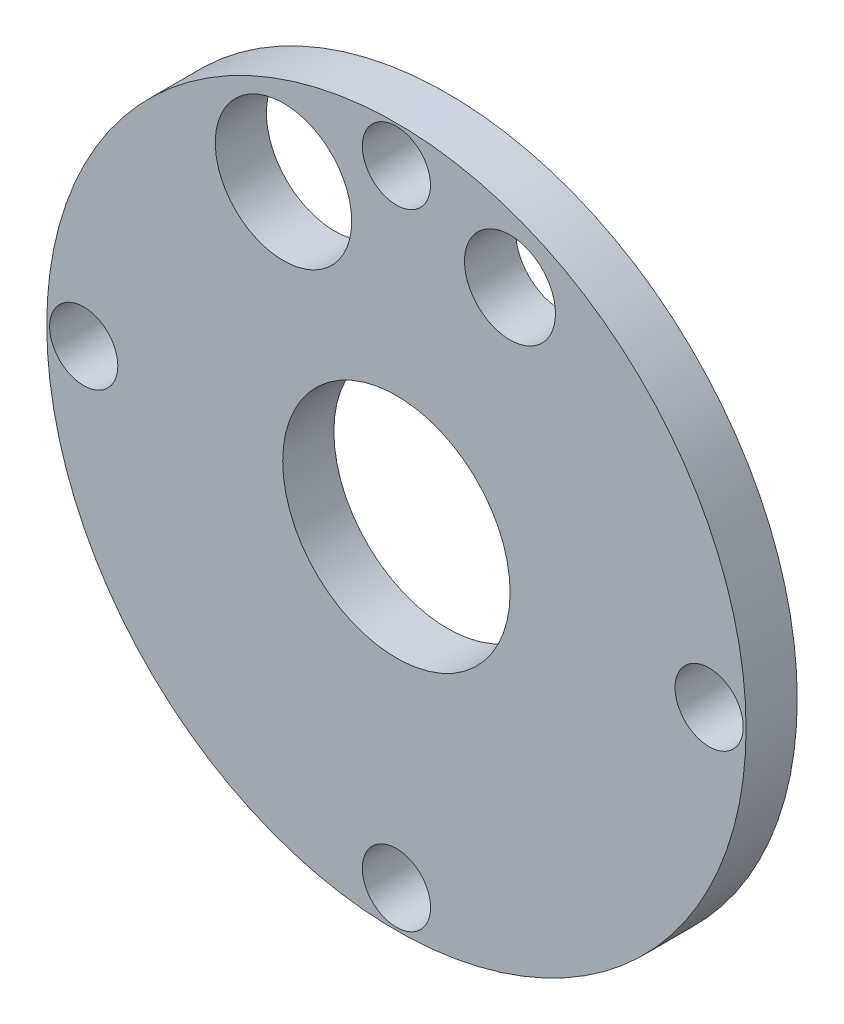
from build123d import *

# Parameters (mm, degrees)
ESQUISSE1_R                  = 30.75
BOSS_EXTRU_1_DEPTH           = 8
ESQUISSE2_R                  = 3
BOSS_EXTRU_2_DEPTH           = 56
ESQUISSE4_R                  = 30.75
BOSS_EXTRU_4_DEPTH           = 4.5
ESQUISSE6_R                  = 3
BOSS_EXTRU_5_DEPTH           = 40
ESQUISSE12_R                 = 4
ENL_V_MAT_EXTRU_1_DEPTH      = 6
ESQUISSE13_R                 = 6
ENL_V_MAT_EXTRU_2_DEPTH      = 10
ESQUISSE15_R                 = 10
ENL_V_MAT_EXTRU_3_DEPTH      = 10
ESQUISSE18_R                 = 30.75
BOSS_EXTRU_10_DEPTH          = 4.5
ESQUISSE19_R                 = 2.05
ENL_V_MAT_EXTRU_4_DEPTH      = 62
ESQUISSE20_R                 = 3.5
ENL_V_MAT_EXTRU_5_DEPTH      = 10
ESQUISSE21_R                 = 3
ENL_V_MAT_EXTRU_6_DEPTH      = 78.376514687
ENL_V_MAT_EXTRU_7_DEPTH      = 122.079003185
ENL_V_MAT_EXTRU_7_DEPTH_BACK = 122.079003185
ESQUISSE22_W                 = 61.5
ESQUISSE22_H                 = 64
ESQUISSE22_H_2               = 4.5


with BuildPart() as part:
    # Esquisse1 → Boss.-Extru.1 (new body)
    with BuildSketch(Plane.XY):
        Circle(ESQUISSE1_R)
    extrude(amount=BOSS_EXTRU_1_DEPTH)

    # Esquisse2 → Boss.-Extru.2 (add)
    with BuildSketch(Plane.XY.offset(8)):
        with Locations((0, 27.5)):
            Circle(ESQUISSE2_R)
        with Locations((27.5, 0)):
            Circle(ESQUISSE2_R)
        with Locations((-27.5, 0)):
            Circle(ESQUISSE2_R)
        with Locations((0, -27.5)):
            Circle(ESQUISSE2_R)
    extrude(amount=BOSS_EXTRU_2_DEPTH)

    # Esquisse4 → Boss.-Extru.4 (add)
    with BuildSketch(Plane.XY.offset(64)):
        Circle(ESQUISSE4_R)
    extrude(amount=BOSS_EXTRU_4_DEPTH)

    # Esquisse6 → Boss.-Extru.5 (add)
    with BuildSketch(Plane.XY.offset(68.5)):
        with Locations((0, -27.5)):
            Circle(ESQUISSE6_R)
        with Locations((-27.5, 0)):
            Circle(ESQUISSE6_R)
        with Locations((0, 27.5)):
            Circle(ESQUISSE6_R)
        with Locations((27.5, 0)):
            Circle(ESQUISSE6_R)
    extrude(amount=BOSS_EXTRU_5_DEPTH)

    # Esquisse12 → Enlèv. mat.-Extru.1 (cut)
    with BuildSketch(Plane.XY.offset(68.5)):
        with Locations((9.98690327, 23.224420757)):
            Circle(ESQUISSE12_R)
    extrude(amount=-ENL_V_MAT_EXTRU_1_DEPTH, mode=Mode.SUBTRACT)

    # Esquisse13 → Enlèv. mat.-Extru.2 (cut)
    with BuildSketch(Plane.XY.offset(68.5)):
        with Locations((-9.931529151, 21.298232995)):
            Circle(ESQUISSE13_R)
    extrude(amount=-ENL_V_MAT_EXTRU_2_DEPTH, mode=Mode.SUBTRACT)

    # Esquisse15 → Enlèv. mat.-Extru.3 (cut)
    with BuildSketch(Plane.XY.offset(68.5)):
        Circle(ESQUISSE15_R)
    extrude(amount=-ENL_V_MAT_EXTRU_3_DEPTH, mode=Mode.SUBTRACT)

    # Esquisse18 → Boss.-Extru.10 (add)
    with BuildSketch(Plane.XY.offset(108.5)):
        Circle(ESQUISSE18_R)
    extrude(amount=BOSS_EXTRU_10_DEPTH)

    # Esquisse19 → Enlèv. mat.-Extru.4 (cut)
    with BuildSketch(Plane.ZY.offset(30.75)):
        with Locations((4, 0.25)):
            Circle(ESQUISSE19_R)
    extrude(amount=-ENL_V_MAT_EXTRU_4_DEPTH, mode=Mode.SUBTRACT)

    # Esquisse20 → Enlèv. mat.-Extru.5 (cut)
    with BuildSketch(Plane.XY.offset(113)):
        with Locations((21.297953152, 14.912987345)):
            Circle(ESQUISSE20_R)
        with Locations((-14.912987345, 21.297953152)):
            Circle(ESQUISSE20_R)
        with Locations((-21.297953152, -14.912987345)):
            Circle(ESQUISSE20_R)
        with Locations((14.912987345, -21.297953152)):
            Circle(ESQUISSE20_R)
    extrude(amount=-ENL_V_MAT_EXTRU_5_DEPTH, mode=Mode.SUBTRACT)

    # Esquisse21 → Enlèv. mat.-Extru.6 (cut, through all)
    with BuildSketch(Plane(origin=(0, 0, 64), x_dir=(-1, 0, 0), z_dir=(0, 0, -1))):
        with Locations((0, 27.5)):
            Circle(ESQUISSE21_R)
        with Locations((-27.5, 0)):
            Circle(ESQUISSE21_R)
        with Locations((0, -27.5)):
            Circle(ESQUISSE21_R)
        with Locations((27.5, 0)):
            Circle(ESQUISSE21_R)
    extrude(amount=-ENL_V_MAT_EXTRU_6_DEPTH, mode=Mode.SUBTRACT)


with BuildPart() as enl_v_mat_extru_6_piece_1:
    # of the separate pieces the step leaves, piece 1, a body of its own (enl_v_mat_extru_6_pieces)
    add(part.part.solids().sort_by_distance((3, -27.5, 8))[0])


with BuildPart() as enl_v_mat_extru_6_piece_2:
    # of the separate pieces the step leaves, piece 2, a body of its own (enl_v_mat_extru_6_pieces)
    add(part.part.solids().sort_by_distance((30.75, 0, 108.5))[0])


with BuildPart() as enl_v_mat_extru_6_piece_3:
    # of the separate pieces the step leaves, piece 3, a body of its own (enl_v_mat_extru_6_pieces)
    add(part.part.solids().sort_by_distance((30.75, 0, 68.5))[0])


with BuildPart() as enl_v_mat_extru_7_tool:
    # Esquisse22 → Enlèv. mat.-Extru.7 (new, two sides: drawn at the far end of the back side and taken through both)
    with BuildSketch(Plane(origin=(0, 0, 0), x_dir=(1, 0, 0), z_dir=(0, 1, 0)).offset(-ENL_V_MAT_EXTRU_7_DEPTH_BACK)):
        with Locations((0, -32)):
            Rectangle(ESQUISSE22_W, ESQUISSE22_H)
        with Locations((0, -110.75)):
            Rectangle(ESQUISSE22_W, ESQUISSE22_H_2)
    extrude(amount=ENL_V_MAT_EXTRU_7_DEPTH + ENL_V_MAT_EXTRU_7_DEPTH_BACK)


with BuildPart() as enl_v_mat_extru_6_piece_1_1:
    add(enl_v_mat_extru_6_piece_1.part)

    # Enlèv. mat.-Extru.7: cut by enl_v_mat_extru_7_tool
    add(enl_v_mat_extru_7_tool.part, mode=Mode.SUBTRACT)


with BuildPart() as enl_v_mat_extru_6_piece_2_1:
    add(enl_v_mat_extru_6_piece_2.part)

    # Enlèv. mat.-Extru.7: cut by enl_v_mat_extru_7_tool
    add(enl_v_mat_extru_7_tool.part, mode=Mode.SUBTRACT)


solid = enl_v_mat_extru_6_piece_3.part
